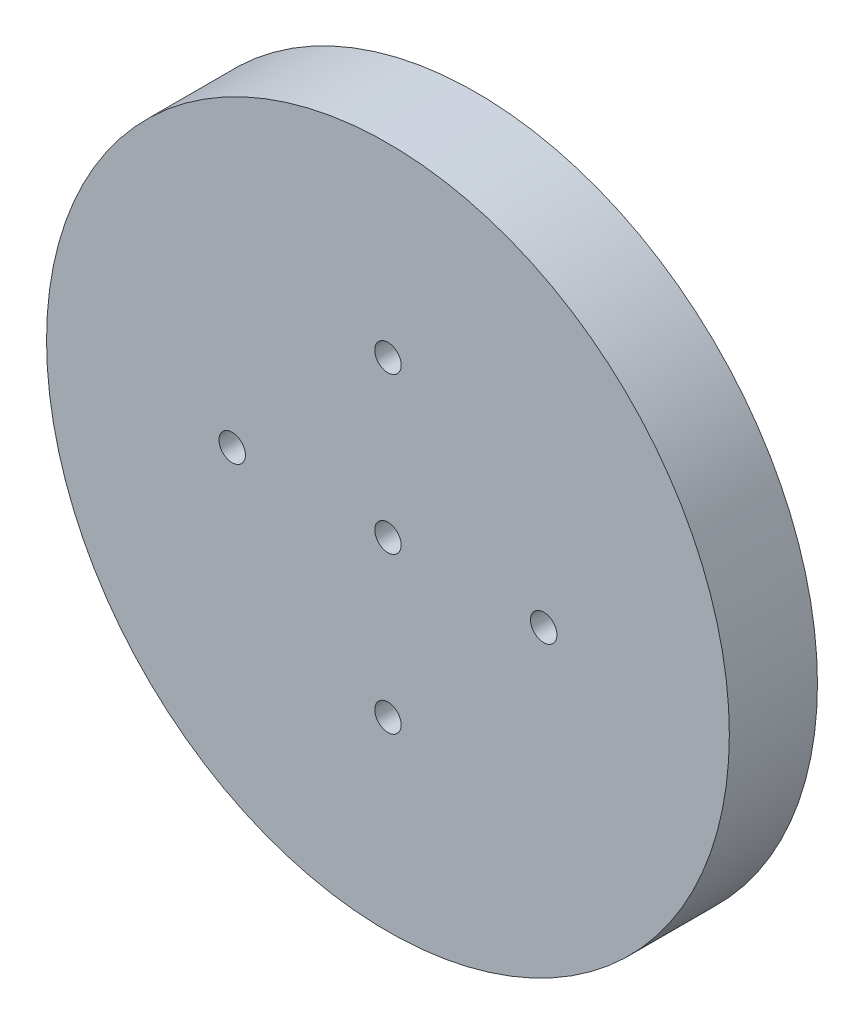
from build123d import *

# Parameters (mm, degrees)
SKETCH_1_R          = 38.75
EXTRUDE_1_DEPTH     = 10
SKETCH_2_R          = 37
CUT_EXTRUDE_1_DEPTH = 7
SKETCH_3_R          = 10
EXTRUDE_2_DEPTH     = 1
SKETCH_4_R          = 1.5
CUT_EXTRUDE_2_DEPTH = 56.705699888


with BuildPart() as part:
    # 草图1 → 凸台-拉伸1 (new body)
    with BuildSketch(Plane.XY):
        Circle(SKETCH_1_R)
    extrude(amount=EXTRUDE_1_DEPTH)

    # 草图2 → 切除-拉伸1 (cut)
    with BuildSketch(Plane(origin=(0, 0, 0), x_dir=(-1, 0, 0), z_dir=(0, 0, -1))):
        Circle(SKETCH_2_R)
    extrude(amount=-CUT_EXTRUDE_1_DEPTH, mode=Mode.SUBTRACT)

    # 草图3 → 凸台-拉伸2 (add)
    with BuildSketch(Plane(origin=(0, 0, 7), x_dir=(-1, 0, 0), z_dir=(0, 0, -1))):
        Circle(SKETCH_3_R)
    extrude(amount=EXTRUDE_2_DEPTH)

    # 草图4 → 切除-拉伸2 (cut, through all)
    with BuildSketch(Plane.XY.offset(10)):
        with Locations((0, 17.67766953)):
            Circle(SKETCH_4_R)
        with Locations((17.67766953, 0)):
            Circle(SKETCH_4_R)
        with Locations((0, -17.67766953)):
            Circle(SKETCH_4_R)
        with Locations((-17.67766953, 0)):
            Circle(SKETCH_4_R)
        Circle(SKETCH_4_R)
    extrude(amount=-CUT_EXTRUDE_2_DEPTH, mode=Mode.SUBTRACT)


solid = part.part
